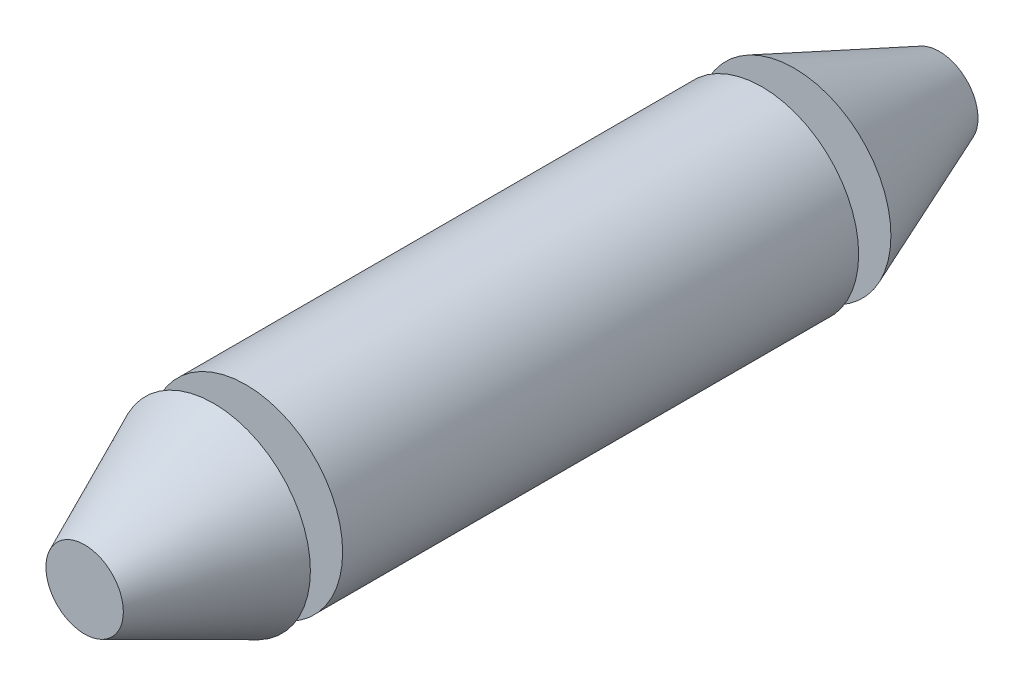
from build123d import *

# Parameters (mm, degrees)
ESQUISSE1_R      = 3
EXTRUSION1_DEPTH = 16
ESQUISSE2_R      = 1.2
EXTRUSION2_DEPTH = 5
EXTRUSION3_START = 5.5
ESQUISSE3_R      = 1.2
EXTRUSION3_DEPTH = 5.5


with BuildPart() as part:
    # Esquisse1 → Extrusion1 (new body)
    with BuildSketch(Plane.XY):
        Circle(ESQUISSE1_R)
    extrude(amount=EXTRUSION1_DEPTH)

    # Esquisse2 → Extrusion2 (add)
    with BuildSketch(Plane.XY.offset(16)):
        Circle(ESQUISSE2_R)
    extrude(amount=EXTRUSION2_DEPTH)

    # Esquisse3 → Extrusion3 (add)
    with BuildSketch(Plane(origin=(0, 0, 0), x_dir=(-1, 0, 0), z_dir=(0, 0, -1)).offset(EXTRUSION3_START)):
        with Locations(Location((0, 0, 0), (0, 0, 180))):
            Circle(ESQUISSE3_R)
    extrude(amount=-EXTRUSION3_DEPTH)

    # Esquisse4 → Révolution1 (revolve)
    with BuildSketch(Plane(origin=(0, 0, 0), x_dir=(1, 0, 0), z_dir=(0, 1, 0))):
        Polygon((1.2, 5.5), (3, 1), (0, 1), (0, 5.5), align=None)
        Polygon((0, -21), (1.2, -21), (3, -17), (0, -17), align=None)
    revolve(axis=Axis((0, 0, 16), (0, 0, -1)))


solid = part.part
